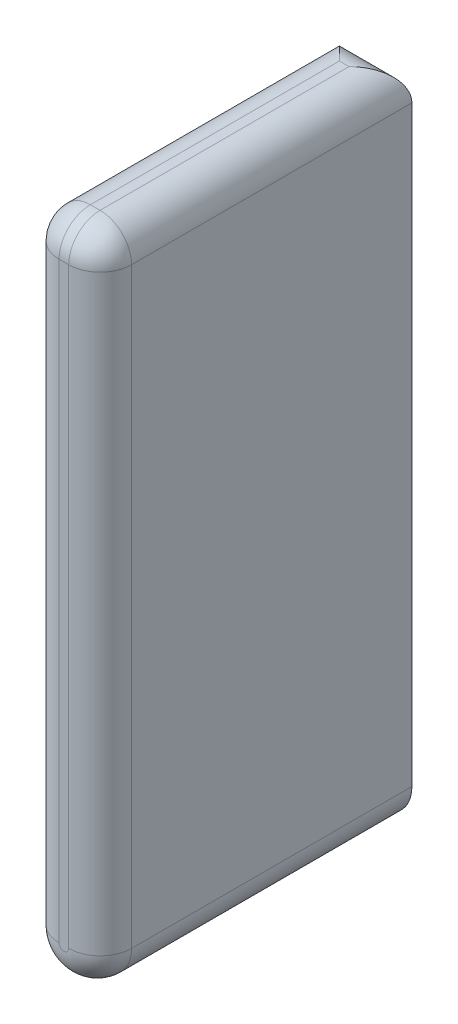
from build123d import *

# Parameters (mm, degrees)
SKETCH1_R           = 75
BOSS_EXTRUDE1_DEPTH = 645
SKETCH2_W           = 150
SKETCH2_H           = 645
BOSS_EXTRUDE2_DEPTH = 1290
FILLET1_R           = 65


with BuildPart() as part:
    # Sketch1 → Boss-Extrude1 (new body)
    with BuildSketch(Plane.XY):
        with Locations(Location((0, 0, 0), (0, 0, 180))):
            Circle(SKETCH1_R)
    extrude(amount=BOSS_EXTRUDE1_DEPTH)

    # Sketch2 → Boss-Extrude2 (add)
    with BuildSketch(Plane(origin=(0, 0, 0), x_dir=(1, 0, 0), z_dir=(0, 1, 0))):
        with Locations((0, -322.5)):
            Rectangle(SKETCH2_W, SKETCH2_H)
    extrude(amount=BOSS_EXTRUDE2_DEPTH)

    # Fillet1
    fillet1_edges = [part.edges().sort_by_distance(p)[0] for p in [
        (-75, 645, 645),
        (75, 645, 645),
        (-75, 1290, 322.5),
        (0, 1290, 645),
        (75, 1290, 322.5),
        (0, 1290, 0),
        (0, -75, 645),
    ]]
    fillet(fillet1_edges, radius=FILLET1_R)


solid = part.part
